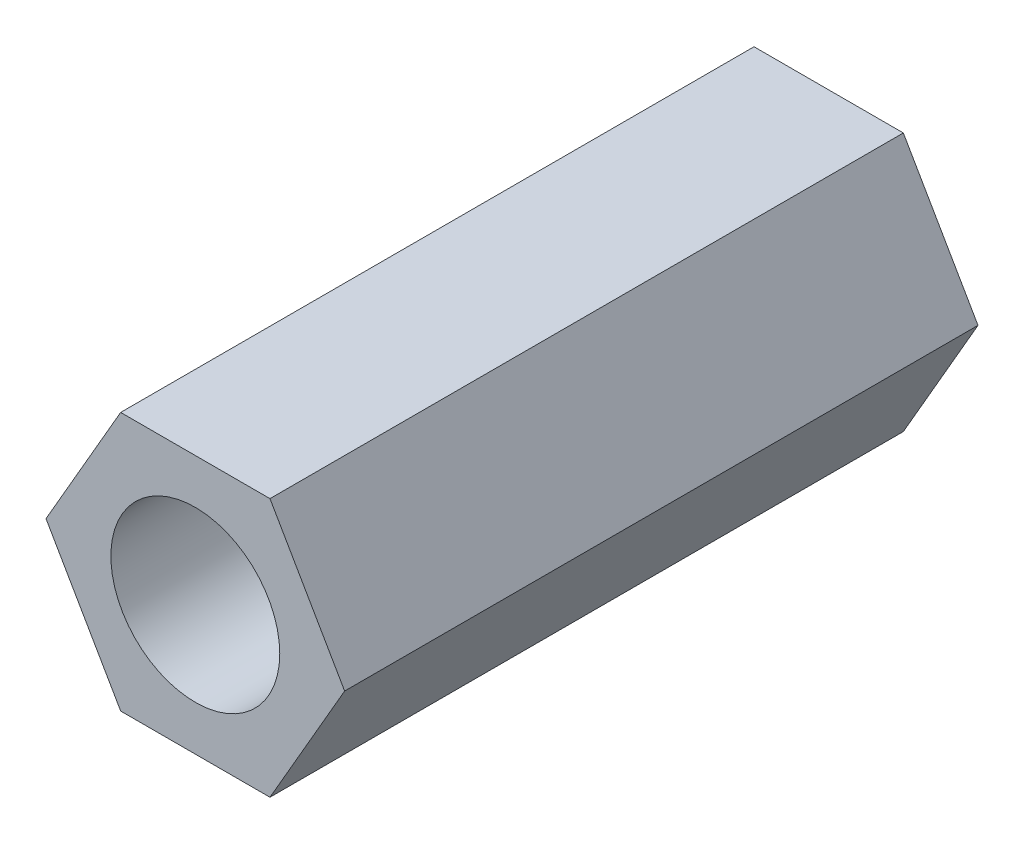
from build123d import *

# Parameters (mm, degrees)
SKETCH_1_R      = 1.6
EXTRUDE_1_DEPTH = 12


with BuildPart() as part:
    # 草图1 → 凸台-拉伸1 (new body)
    with BuildSketch(Plane.XY):
        Polygon((2.829016319, 0), (1.41450816, 2.45), (-1.41450816, 2.45), (-2.829016319, 0), (-1.41450816, -2.45), (1.41450816, -2.45), align=None)
        Circle(SKETCH_1_R, mode=Mode.SUBTRACT)
    extrude(amount=EXTRUDE_1_DEPTH)


solid = part.part
